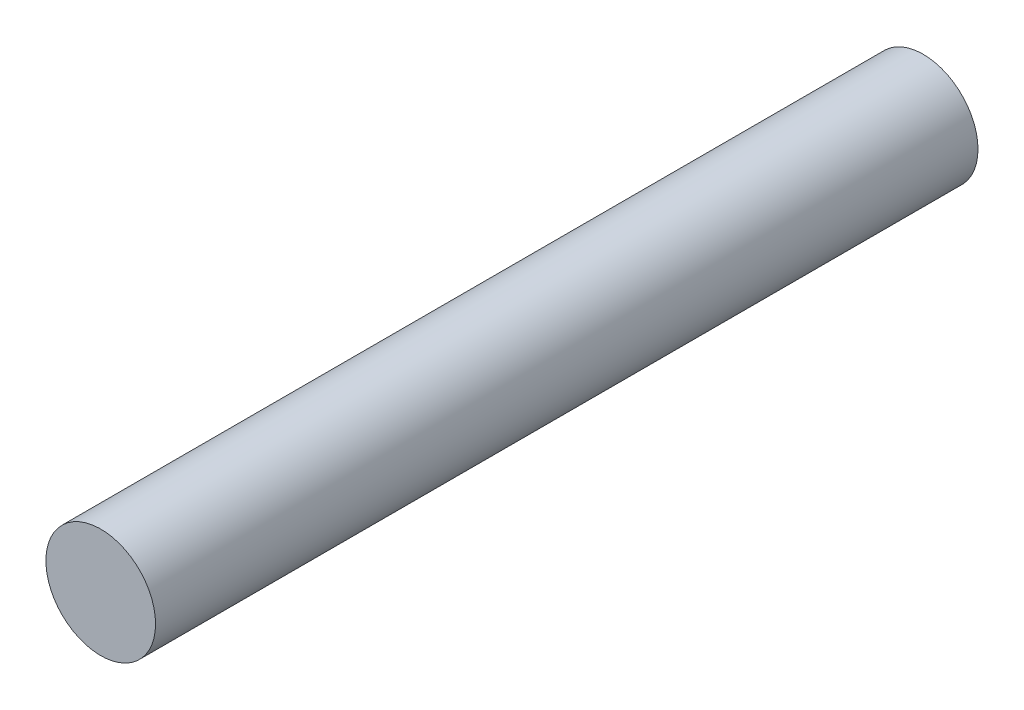
from build123d import *

# Parameters (mm, degrees)
ESQUISSE1_R        = 10
BOSS_EXTRU_1_DEPTH = 150


with BuildPart() as part:
    # Esquisse1 → Boss.-Extru.1 (new body)
    with BuildSketch(Plane.XY):
        Circle(ESQUISSE1_R)
    extrude(amount=BOSS_EXTRU_1_DEPTH)


solid = part.part
